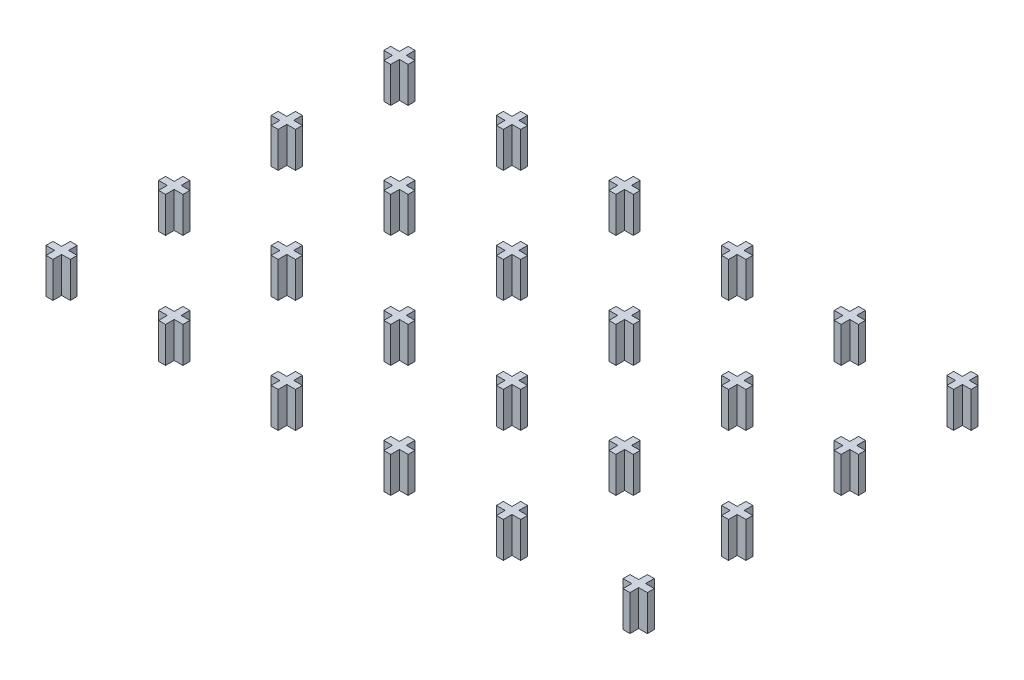
from build123d import *

# Parameters (mm, degrees)
BOSS_EXTRUDE1_DEPTH    = 6
BOSS_EXTRUDE1_2_DEPTH  = 6
BOSS_EXTRUDE1_3_DEPTH  = 6
BOSS_EXTRUDE1_4_DEPTH  = 6
BOSS_EXTRUDE1_5_DEPTH  = 6
BOSS_EXTRUDE1_6_DEPTH  = 6
BOSS_EXTRUDE1_7_DEPTH  = 6
BOSS_EXTRUDE1_8_DEPTH  = 6
BOSS_EXTRUDE1_9_DEPTH  = 6
BOSS_EXTRUDE1_10_DEPTH = 6
BOSS_EXTRUDE1_11_DEPTH = 6
BOSS_EXTRUDE1_12_DEPTH = 6
BOSS_EXTRUDE1_13_DEPTH = 6
BOSS_EXTRUDE1_14_DEPTH = 6
BOSS_EXTRUDE1_15_DEPTH = 6
BOSS_EXTRUDE1_16_DEPTH = 6
BOSS_EXTRUDE1_17_DEPTH = 6
BOSS_EXTRUDE1_18_DEPTH = 6
BOSS_EXTRUDE1_19_DEPTH = 6
BOSS_EXTRUDE1_20_DEPTH = 6
BOSS_EXTRUDE1_21_DEPTH = 6
BOSS_EXTRUDE1_22_DEPTH = 6
BOSS_EXTRUDE1_23_DEPTH = 6
BOSS_EXTRUDE1_24_DEPTH = 6


with BuildPart() as part:
    # Sketch1 → Boss-Extrude1 (new body)
    with BuildSketch(Plane(origin=(0, 0, 0), x_dir=(1, 0, 0), z_dir=(0, 1, 0))):
        Polygon((-61.87264188, 22.127287386), (-60.70264188, 22.127287386), (-60.70264188, 20.662287386), (-59.23764188, 20.662287386), (-59.23764188, 19.492287386), (-60.70264188, 19.492287386), (-60.70264188, 18.027287386), (-61.87264188, 18.027287386), (-61.87264188, 19.492287386), (-63.33764188, 19.492287386), (-63.33764188, 20.662287386), (-61.87264188, 20.662287386), align=None)
    extrude(amount=BOSS_EXTRUDE1_DEPTH)


with BuildPart() as body_2:
    # Sketch1 → Boss-Extrude1 2 (new body)
    with BuildSketch(Plane(origin=(0, 0, 0), x_dir=(1, 0, 0), z_dir=(0, 1, 0))):
        Polygon((-61.87264188, 3.127287386), (-60.70264188, 3.127287386), (-60.70264188, 1.662287386), (-59.23764188, 1.662287386), (-59.23764188, 0.492287386), (-60.70264188, 0.492287386), (-60.70264188, -0.972712614), (-61.87264188, -0.972712614), (-61.87264188, 0.492287386), (-63.33764188, 0.492287386), (-63.33764188, 1.662287386), (-61.87264188, 1.662287386), align=None)
    extrude(amount=BOSS_EXTRUDE1_2_DEPTH)


with BuildPart() as body_3:
    # Sketch1 → Boss-Extrude1 3 (new body)
    with BuildSketch(Plane(origin=(0, 0, 0), x_dir=(1, 0, 0), z_dir=(0, 1, 0))):
        Polygon((-61.87264188, -15.872712614), (-60.70264188, -15.872712614), (-60.70264188, -17.337712614), (-59.23764188, -17.337712614), (-59.23764188, -18.507712614), (-60.70264188, -18.507712614), (-60.70264188, -19.972712614), (-61.87264188, -19.972712614), (-61.87264188, -18.507712614), (-63.33764188, -18.507712614), (-63.33764188, -17.337712614), (-61.87264188, -17.337712614), align=None)
    extrude(amount=BOSS_EXTRUDE1_3_DEPTH)


with BuildPart() as body_4:
    # Sketch1 → Boss-Extrude1 4 (new body)
    with BuildSketch(Plane(origin=(0, 0, 0), x_dir=(1, 0, 0), z_dir=(0, 1, 0))):
        Polygon((-42.87264188, -15.872712614), (-41.70264188, -15.872712614), (-41.70264188, -17.337712614), (-40.23764188, -17.337712614), (-40.23764188, -18.507712614), (-41.70264188, -18.507712614), (-41.70264188, -19.972712614), (-42.87264188, -19.972712614), (-42.87264188, -18.507712614), (-44.33764188, -18.507712614), (-44.33764188, -17.337712614), (-42.87264188, -17.337712614), align=None)
    extrude(amount=BOSS_EXTRUDE1_4_DEPTH)


with BuildPart() as body_5:
    # Sketch1 → Boss-Extrude1 5 (new body)
    with BuildSketch(Plane(origin=(0, 0, 0), x_dir=(1, 0, 0), z_dir=(0, 1, 0))):
        Polygon((-42.87264188, 3.127287386), (-41.70264188, 3.127287386), (-41.70264188, 1.662287386), (-40.23764188, 1.662287386), (-40.23764188, 0.492287386), (-41.70264188, 0.492287386), (-41.70264188, -0.972712614), (-42.87264188, -0.972712614), (-42.87264188, 0.492287386), (-44.33764188, 0.492287386), (-44.33764188, 1.662287386), (-42.87264188, 1.662287386), align=None)
    extrude(amount=BOSS_EXTRUDE1_5_DEPTH)


with BuildPart() as body_6:
    # Sketch1 → Boss-Extrude1 6 (new body)
    with BuildSketch(Plane(origin=(0, 0, 0), x_dir=(1, 0, 0), z_dir=(0, 1, 0))):
        Polygon((-42.87264188, 22.127287386), (-41.70264188, 22.127287386), (-41.70264188, 20.662287386), (-40.23764188, 20.662287386), (-40.23764188, 19.492287386), (-41.70264188, 19.492287386), (-41.70264188, 18.027287386), (-42.87264188, 18.027287386), (-42.87264188, 19.492287386), (-44.33764188, 19.492287386), (-44.33764188, 20.662287386), (-42.87264188, 20.662287386), align=None)
    extrude(amount=BOSS_EXTRUDE1_6_DEPTH)


with BuildPart() as body_7:
    # Sketch1 → Boss-Extrude1 7 (new body)
    with BuildSketch(Plane(origin=(0, 0, 0), x_dir=(1, 0, 0), z_dir=(0, 1, 0))):
        Polygon((-23.87264188, 22.127287386), (-22.70264188, 22.127287386), (-22.70264188, 20.662287386), (-21.23764188, 20.662287386), (-21.23764188, 19.492287386), (-22.70264188, 19.492287386), (-22.70264188, 18.027287386), (-23.87264188, 18.027287386), (-23.87264188, 19.492287386), (-25.33764188, 19.492287386), (-25.33764188, 20.662287386), (-23.87264188, 20.662287386), align=None)
    extrude(amount=BOSS_EXTRUDE1_7_DEPTH)


with BuildPart() as body_8:
    # Sketch1 → Boss-Extrude1 8 (new body)
    with BuildSketch(Plane(origin=(0, 0, 0), x_dir=(1, 0, 0), z_dir=(0, 1, 0))):
        Polygon((-23.87264188, 3.127287386), (-22.70264188, 3.127287386), (-22.70264188, 1.662287386), (-21.23764188, 1.662287386), (-21.23764188, 0.492287386), (-22.70264188, 0.492287386), (-22.70264188, -0.972712614), (-23.87264188, -0.972712614), (-23.87264188, 0.492287386), (-25.33764188, 0.492287386), (-25.33764188, 1.662287386), (-23.87264188, 1.662287386), align=None)
    extrude(amount=BOSS_EXTRUDE1_8_DEPTH)


with BuildPart() as body_9:
    # Sketch1 → Boss-Extrude1 9 (new body)
    with BuildSketch(Plane(origin=(0, 0, 0), x_dir=(1, 0, 0), z_dir=(0, 1, 0))):
        Polygon((-23.87264188, -15.872712614), (-22.70264188, -15.872712614), (-22.70264188, -17.337712614), (-21.23764188, -17.337712614), (-21.23764188, -18.507712614), (-22.70264188, -18.507712614), (-22.70264188, -19.972712614), (-23.87264188, -19.972712614), (-23.87264188, -18.507712614), (-25.33764188, -18.507712614), (-25.33764188, -17.337712614), (-23.87264188, -17.337712614), align=None)
    extrude(amount=BOSS_EXTRUDE1_9_DEPTH)


with BuildPart() as body_10:
    # Sketch1 → Boss-Extrude1 10 (new body)
    with BuildSketch(Plane(origin=(0, 0, 0), x_dir=(1, 0, 0), z_dir=(0, 1, 0))):
        Polygon((-4.87264188, -15.872712614), (-3.70264188, -15.872712614), (-3.70264188, -17.337712614), (-2.23764188, -17.337712614), (-2.23764188, -18.507712614), (-3.70264188, -18.507712614), (-3.70264188, -19.972712614), (-4.87264188, -19.972712614), (-4.87264188, -18.507712614), (-6.33764188, -18.507712614), (-6.33764188, -17.337712614), (-4.87264188, -17.337712614), align=None)
    extrude(amount=BOSS_EXTRUDE1_10_DEPTH)


with BuildPart() as body_11:
    # Sketch1 → Boss-Extrude1 11 (new body)
    with BuildSketch(Plane(origin=(0, 0, 0), x_dir=(1, 0, 0), z_dir=(0, 1, 0))):
        Polygon((-4.87264188, 3.127287386), (-3.70264188, 3.127287386), (-3.70264188, 1.662287386), (-2.23764188, 1.662287386), (-2.23764188, 0.492287386), (-3.70264188, 0.492287386), (-3.70264188, -0.972712614), (-4.87264188, -0.972712614), (-4.87264188, 0.492287386), (-6.33764188, 0.492287386), (-6.33764188, 1.662287386), (-4.87264188, 1.662287386), align=None)
    extrude(amount=BOSS_EXTRUDE1_11_DEPTH)


with BuildPart() as body_12:
    # Sketch1 → Boss-Extrude1 12 (new body)
    with BuildSketch(Plane(origin=(0, 0, 0), x_dir=(1, 0, 0), z_dir=(0, 1, 0))):
        Polygon((-4.87264188, 22.127287386), (-3.70264188, 22.127287386), (-3.70264188, 20.662287386), (-2.23764188, 20.662287386), (-2.23764188, 19.492287386), (-3.70264188, 19.492287386), (-3.70264188, 18.027287386), (-4.87264188, 18.027287386), (-4.87264188, 19.492287386), (-6.33764188, 19.492287386), (-6.33764188, 20.662287386), (-4.87264188, 20.662287386), align=None)
    extrude(amount=BOSS_EXTRUDE1_12_DEPTH)


with BuildPart() as body_13:
    # Sketch1 → Boss-Extrude1 13 (new body)
    with BuildSketch(Plane(origin=(0, 0, 0), x_dir=(1, 0, 0), z_dir=(0, 1, 0))):
        Polygon((14.12735812, 22.127287386), (15.29735812, 22.127287386), (15.29735812, 20.662287386), (16.76235812, 20.662287386), (16.76235812, 19.492287386), (15.29735812, 19.492287386), (15.29735812, 18.027287386), (14.12735812, 18.027287386), (14.12735812, 19.492287386), (12.66235812, 19.492287386), (12.66235812, 20.662287386), (14.12735812, 20.662287386), align=None)
    extrude(amount=BOSS_EXTRUDE1_13_DEPTH)


with BuildPart() as body_14:
    # Sketch1 → Boss-Extrude1 14 (new body)
    with BuildSketch(Plane(origin=(0, 0, 0), x_dir=(1, 0, 0), z_dir=(0, 1, 0))):
        Polygon((14.12735812, 3.127287386), (15.29735812, 3.127287386), (15.29735812, 1.662287386), (16.76235812, 1.662287386), (16.76235812, 0.492287386), (15.29735812, 0.492287386), (15.29735812, -0.972712614), (14.12735812, -0.972712614), (14.12735812, 0.492287386), (12.66235812, 0.492287386), (12.66235812, 1.662287386), (14.12735812, 1.662287386), align=None)
    extrude(amount=BOSS_EXTRUDE1_14_DEPTH)


with BuildPart() as body_15:
    # Sketch1 → Boss-Extrude1 15 (new body)
    with BuildSketch(Plane(origin=(0, 0, 0), x_dir=(1, 0, 0), z_dir=(0, 1, 0))):
        Polygon((14.12735812, -15.872712614), (15.29735812, -15.872712614), (15.29735812, -17.337712614), (16.76235812, -17.337712614), (16.76235812, -18.507712614), (15.29735812, -18.507712614), (15.29735812, -19.972712614), (14.12735812, -19.972712614), (14.12735812, -18.507712614), (12.66235812, -18.507712614), (12.66235812, -17.337712614), (14.12735812, -17.337712614), align=None)
    extrude(amount=BOSS_EXTRUDE1_15_DEPTH)


with BuildPart() as body_16:
    # Sketch1 → Boss-Extrude1 16 (new body)
    with BuildSketch(Plane(origin=(0, 0, 0), x_dir=(1, 0, 0), z_dir=(0, 1, 0))):
        Polygon((33.12735812, -15.872712614), (34.29735812, -15.872712614), (34.29735812, -17.337712614), (35.76235812, -17.337712614), (35.76235812, -18.507712614), (34.29735812, -18.507712614), (34.29735812, -19.972712614), (33.12735812, -19.972712614), (33.12735812, -18.507712614), (31.66235812, -18.507712614), (31.66235812, -17.337712614), (33.12735812, -17.337712614), align=None)
    extrude(amount=BOSS_EXTRUDE1_16_DEPTH)


with BuildPart() as body_17:
    # Sketch1 → Boss-Extrude1 17 (new body)
    with BuildSketch(Plane(origin=(0, 0, 0), x_dir=(1, 0, 0), z_dir=(0, 1, 0))):
        Polygon((33.12735812, 3.127287386), (34.29735812, 3.127287386), (34.29735812, 1.662287386), (35.76235812, 1.662287386), (35.76235812, 0.492287386), (34.29735812, 0.492287386), (34.29735812, -0.972712614), (33.12735812, -0.972712614), (33.12735812, 0.492287386), (31.66235812, 0.492287386), (31.66235812, 1.662287386), (33.12735812, 1.662287386), align=None)
    extrude(amount=BOSS_EXTRUDE1_17_DEPTH)


with BuildPart() as body_18:
    # Sketch1 → Boss-Extrude1 18 (new body)
    with BuildSketch(Plane(origin=(0, 0, 0), x_dir=(1, 0, 0), z_dir=(0, 1, 0))):
        Polygon((33.12735812, 22.127287386), (34.29735812, 22.127287386), (34.29735812, 20.662287386), (35.76235812, 20.662287386), (35.76235812, 19.492287386), (34.29735812, 19.492287386), (34.29735812, 18.027287386), (33.12735812, 18.027287386), (33.12735812, 19.492287386), (31.66235812, 19.492287386), (31.66235812, 20.662287386), (33.12735812, 20.662287386), align=None)
    extrude(amount=BOSS_EXTRUDE1_18_DEPTH)


with BuildPart() as body_19:
    # Sketch1 → Boss-Extrude1 19 (new body)
    with BuildSketch(Plane(origin=(0, 0, 0), x_dir=(1, 0, 0), z_dir=(0, 1, 0))):
        Polygon((35.50235812, -34.872712614), (36.67235812, -34.872712614), (36.67235812, -36.337712614), (38.13735812, -36.337712614), (38.13735812, -37.507712614), (36.67235812, -37.507712614), (36.67235812, -38.972712614), (35.50235812, -38.972712614), (35.50235812, -37.507712614), (34.03735812, -37.507712614), (34.03735812, -36.337712614), (35.50235812, -36.337712614), align=None)
    extrude(amount=BOSS_EXTRUDE1_19_DEPTH)


with BuildPart() as body_20:
    # Sketch1 → Boss-Extrude1 20 (new body)
    with BuildSketch(Plane(origin=(0, 0, 0), x_dir=(1, 0, 0), z_dir=(0, 1, 0))):
        Polygon((-61.87264188, -34.872712614), (-60.70264188, -34.872712614), (-60.70264188, -36.337712614), (-59.23764188, -36.337712614), (-59.23764188, -37.507712614), (-60.70264188, -37.507712614), (-60.70264188, -38.972712614), (-61.87264188, -38.972712614), (-61.87264188, -37.507712614), (-63.33764188, -37.507712614), (-63.33764188, -36.337712614), (-61.87264188, -36.337712614), align=None)
    extrude(amount=BOSS_EXTRUDE1_20_DEPTH)


with BuildPart() as body_21:
    # Sketch1 → Boss-Extrude1 21 (new body)
    with BuildSketch(Plane(origin=(0, 0, 0), x_dir=(1, 0, 0), z_dir=(0, 1, 0))):
        Polygon((-42.87264188, -34.872712614), (-41.70264188, -34.872712614), (-41.70264188, -36.337712614), (-40.23764188, -36.337712614), (-40.23764188, -37.507712614), (-41.70264188, -37.507712614), (-41.70264188, -38.972712614), (-42.87264188, -38.972712614), (-42.87264188, -37.507712614), (-44.33764188, -37.507712614), (-44.33764188, -36.337712614), (-42.87264188, -36.337712614), align=None)
    extrude(amount=BOSS_EXTRUDE1_21_DEPTH)


with BuildPart() as body_22:
    # Sketch1 → Boss-Extrude1 22 (new body)
    with BuildSketch(Plane(origin=(0, 0, 0), x_dir=(1, 0, 0), z_dir=(0, 1, 0))):
        Polygon((-23.87264188, -34.872712614), (-22.70264188, -34.872712614), (-22.70264188, -36.337712614), (-21.23764188, -36.337712614), (-21.23764188, -37.507712614), (-22.70264188, -37.507712614), (-22.70264188, -38.972712614), (-23.87264188, -38.972712614), (-23.87264188, -37.507712614), (-25.33764188, -37.507712614), (-25.33764188, -36.337712614), (-23.87264188, -36.337712614), align=None)
    extrude(amount=BOSS_EXTRUDE1_22_DEPTH)


with BuildPart() as body_23:
    # Sketch1 → Boss-Extrude1 23 (new body)
    with BuildSketch(Plane(origin=(0, 0, 0), x_dir=(1, 0, 0), z_dir=(0, 1, 0))):
        Polygon((-4.87264188, -34.872712614), (-3.70264188, -34.872712614), (-3.70264188, -36.337712614), (-2.23764188, -36.337712614), (-2.23764188, -37.507712614), (-3.70264188, -37.507712614), (-3.70264188, -38.972712614), (-4.87264188, -38.972712614), (-4.87264188, -37.507712614), (-6.33764188, -37.507712614), (-6.33764188, -36.337712614), (-4.87264188, -36.337712614), align=None)
    extrude(amount=BOSS_EXTRUDE1_23_DEPTH)


with BuildPart() as body_24:
    # Sketch1 → Boss-Extrude1 24 (new body)
    with BuildSketch(Plane(origin=(0, 0, 0), x_dir=(1, 0, 0), z_dir=(0, 1, 0))):
        Polygon((14.12735812, -34.872712614), (15.29735812, -34.872712614), (15.29735812, -36.337712614), (16.76235812, -36.337712614), (16.76235812, -37.507712614), (15.29735812, -37.507712614), (15.29735812, -38.972712614), (14.12735812, -38.972712614), (14.12735812, -37.507712614), (12.66235812, -37.507712614), (12.66235812, -36.337712614), (14.12735812, -36.337712614), align=None)
    extrude(amount=BOSS_EXTRUDE1_24_DEPTH)


solid = Compound([part.part, body_2.part, body_3.part, body_4.part, body_5.part, body_6.part, body_7.part, body_8.part, body_9.part, body_10.part, body_11.part, body_12.part, body_13.part, body_14.part, body_15.part, body_16.part, body_17.part, body_18.part, body_19.part, body_20.part, body_21.part, body_22.part, body_23.part, body_24.part])
